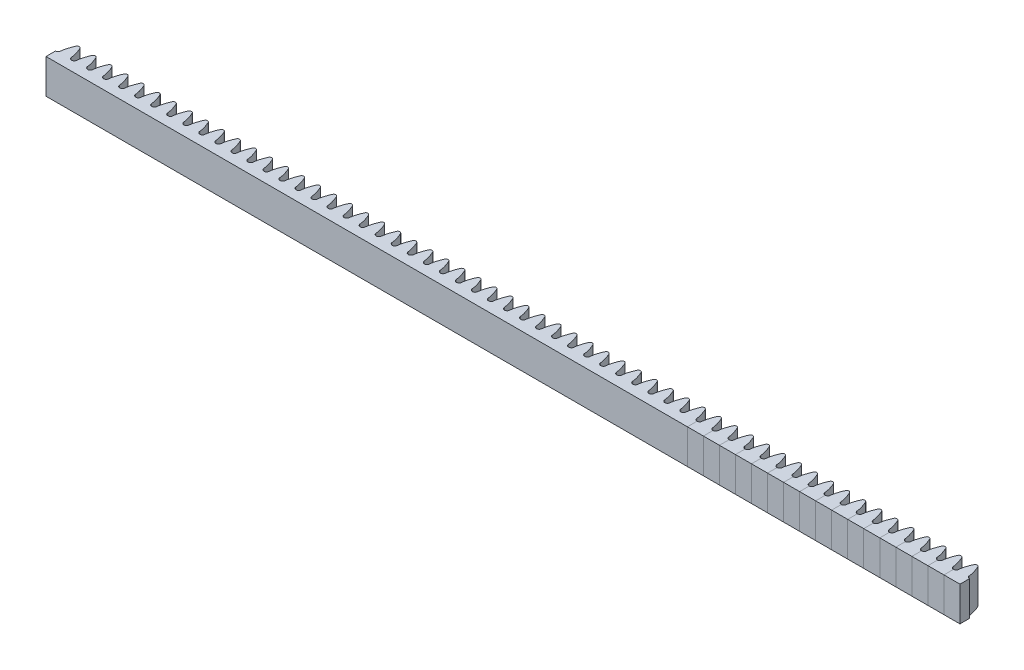
from build123d import *

# Parameters (mm, degrees)
BOSS_EXTRUDE1_DEPTH = 22.86
FILLET1_R           = 1.397
LPATTERN1_COUNT     = 57
LPATTERN1_PITCH     = 10.63952712
SKETCH4_W           = 425.581084806
SKETCH4_H           = 3.175
BOSS_EXTRUDE2_DEPTH = 2.54


with BuildPart() as part:
    # Sketch3 → Boss-Extrude1 (new body)
    with BuildSketch(Plane(origin=(0, 0, 0), x_dir=(1, 0, 0), z_dir=(0, 1, 0))):
        with BuildLine():
            Line((0, -1.750000056), (0, -8.100000056))
            Line((0, -8.100000056), (5.31976356, -8.100000056))
            Line((5.31976356, -8.100000056), (5.31976356, 10.38733641))
            add(Edge.make_bspline(
                [(1.74974471, -0.029893936), (1.750427218, 0.010054461), (1.753658097, 0.081117044), (1.769849983, 0.293177298), (1.812651285, 0.68152723), (1.940138764, 1.498629984), (2.206150355, 2.691050811), (2.620272364, 4.122963174), (3.276086552, 6.018940679), (4.162953405, 8.118570491), (4.960469139, 9.712016225), (5.31976356, 10.38733641)],
                knots=[0, 0, 0, 0, 0.000976543, 0.001953087, 0.003906174, 0.007812348, 0.015624695, 0.023437043, 0.03124939, 0.046874085, 0.058597865, 0.058597865, 0.058597865, 0.058597865], degree=3))
            ThreePointArc((1.74974471, -0.029893936), (1.226822278, -1.247961255), (0, -1.750000056))
        make_face()
    boss_extrude1 = extrude(amount=BOSS_EXTRUDE1_DEPTH)

    # Mirror1: Boss-Extrude1 across plane
    add(boss_extrude1.mirror(Plane(origin=(5.31976356, 22.86, 0), x_dir=(0, 0, 1), z_dir=(1, 0, 0))))

    # Fillet1
    fillet1_edges = [part.edges().sort_by_distance(p)[0] for p in [
        (5.31976356, 11.43, -10.38733641),
    ]]
    fillet(fillet1_edges, radius=FILLET1_R)


with BuildPart() as lpattern1_1:
    # LPattern1: pattern copy
    add(part.part.moved(Location(Vector(1, 0, 0) * (1 * LPATTERN1_PITCH))))


with BuildPart() as lpattern1_2:
    # LPattern1: pattern copy
    add(part.part.moved(Location(Vector(1, 0, 0) * (2 * LPATTERN1_PITCH))))


with BuildPart() as lpattern1_3:
    # LPattern1: pattern copy
    add(part.part.moved(Location(Vector(1, 0, 0) * (3 * LPATTERN1_PITCH))))


with BuildPart() as lpattern1_4:
    # LPattern1: pattern copy
    add(part.part.moved(Location(Vector(1, 0, 0) * (4 * LPATTERN1_PITCH))))


with BuildPart() as lpattern1_5:
    # LPattern1: pattern copy
    add(part.part.moved(Location(Vector(1, 0, 0) * (5 * LPATTERN1_PITCH))))


with BuildPart() as lpattern1_6:
    # LPattern1: pattern copy
    add(part.part.moved(Location(Vector(1, 0, 0) * (6 * LPATTERN1_PITCH))))


with BuildPart() as lpattern1_7:
    # LPattern1: pattern copy
    add(part.part.moved(Location(Vector(1, 0, 0) * (7 * LPATTERN1_PITCH))))


with BuildPart() as lpattern1_8:
    # LPattern1: pattern copy
    add(part.part.moved(Location(Vector(1, 0, 0) * (8 * LPATTERN1_PITCH))))


with BuildPart() as lpattern1_9:
    # LPattern1: pattern copy
    add(part.part.moved(Location(Vector(1, 0, 0) * (9 * LPATTERN1_PITCH))))


with BuildPart() as lpattern1_10:
    # LPattern1: pattern copy
    add(part.part.moved(Location(Vector(1, 0, 0) * (10 * LPATTERN1_PITCH))))


with BuildPart() as lpattern1_11:
    # LPattern1: pattern copy
    add(part.part.moved(Location(Vector(1, 0, 0) * (11 * LPATTERN1_PITCH))))


with BuildPart() as lpattern1_12:
    # LPattern1: pattern copy
    add(part.part.moved(Location(Vector(1, 0, 0) * (12 * LPATTERN1_PITCH))))


with BuildPart() as lpattern1_13:
    # LPattern1: pattern copy
    add(part.part.moved(Location(Vector(1, 0, 0) * (13 * LPATTERN1_PITCH))))


with BuildPart() as lpattern1_14:
    # LPattern1: pattern copy
    add(part.part.moved(Location(Vector(1, 0, 0) * (14 * LPATTERN1_PITCH))))


with BuildPart() as lpattern1_15:
    # LPattern1: pattern copy
    add(part.part.moved(Location(Vector(1, 0, 0) * (15 * LPATTERN1_PITCH))))


with BuildPart() as lpattern1_16:
    # LPattern1: pattern copy
    add(part.part.moved(Location(Vector(1, 0, 0) * (16 * LPATTERN1_PITCH))))


with BuildPart() as lpattern1_17:
    # LPattern1: pattern copy
    add(part.part.moved(Location(Vector(1, 0, 0) * (17 * LPATTERN1_PITCH))))


with BuildPart() as lpattern1_18:
    # LPattern1: pattern copy
    add(part.part.moved(Location(Vector(1, 0, 0) * (18 * LPATTERN1_PITCH))))


with BuildPart() as lpattern1_19:
    # LPattern1: pattern copy
    add(part.part.moved(Location(Vector(1, 0, 0) * (19 * LPATTERN1_PITCH))))


with BuildPart() as lpattern1_20:
    # LPattern1: pattern copy
    add(part.part.moved(Location(Vector(1, 0, 0) * (20 * LPATTERN1_PITCH))))


with BuildPart() as lpattern1_21:
    # LPattern1: pattern copy
    add(part.part.moved(Location(Vector(1, 0, 0) * (21 * LPATTERN1_PITCH))))


with BuildPart() as lpattern1_22:
    # LPattern1: pattern copy
    add(part.part.moved(Location(Vector(1, 0, 0) * (22 * LPATTERN1_PITCH))))


with BuildPart() as lpattern1_23:
    # LPattern1: pattern copy
    add(part.part.moved(Location(Vector(1, 0, 0) * (23 * LPATTERN1_PITCH))))


with BuildPart() as lpattern1_24:
    # LPattern1: pattern copy
    add(part.part.moved(Location(Vector(1, 0, 0) * (24 * LPATTERN1_PITCH))))


with BuildPart() as lpattern1_25:
    # LPattern1: pattern copy
    add(part.part.moved(Location(Vector(1, 0, 0) * (25 * LPATTERN1_PITCH))))


with BuildPart() as lpattern1_26:
    # LPattern1: pattern copy
    add(part.part.moved(Location(Vector(1, 0, 0) * (26 * LPATTERN1_PITCH))))


with BuildPart() as lpattern1_27:
    # LPattern1: pattern copy
    add(part.part.moved(Location(Vector(1, 0, 0) * (27 * LPATTERN1_PITCH))))


with BuildPart() as lpattern1_28:
    # LPattern1: pattern copy
    add(part.part.moved(Location(Vector(1, 0, 0) * (28 * LPATTERN1_PITCH))))


with BuildPart() as lpattern1_29:
    # LPattern1: pattern copy
    add(part.part.moved(Location(Vector(1, 0, 0) * (29 * LPATTERN1_PITCH))))


with BuildPart() as lpattern1_30:
    # LPattern1: pattern copy
    add(part.part.moved(Location(Vector(1, 0, 0) * (30 * LPATTERN1_PITCH))))


with BuildPart() as lpattern1_31:
    # LPattern1: pattern copy
    add(part.part.moved(Location(Vector(1, 0, 0) * (31 * LPATTERN1_PITCH))))


with BuildPart() as lpattern1_32:
    # LPattern1: pattern copy
    add(part.part.moved(Location(Vector(1, 0, 0) * (32 * LPATTERN1_PITCH))))


with BuildPart() as lpattern1_33:
    # LPattern1: pattern copy
    add(part.part.moved(Location(Vector(1, 0, 0) * (33 * LPATTERN1_PITCH))))


with BuildPart() as lpattern1_34:
    # LPattern1: pattern copy
    add(part.part.moved(Location(Vector(1, 0, 0) * (34 * LPATTERN1_PITCH))))


with BuildPart() as lpattern1_35:
    # LPattern1: pattern copy
    add(part.part.moved(Location(Vector(1, 0, 0) * (35 * LPATTERN1_PITCH))))


with BuildPart() as lpattern1_36:
    # LPattern1: pattern copy
    add(part.part.moved(Location(Vector(1, 0, 0) * (36 * LPATTERN1_PITCH))))


with BuildPart() as lpattern1_37:
    # LPattern1: pattern copy
    add(part.part.moved(Location(Vector(1, 0, 0) * (37 * LPATTERN1_PITCH))))


with BuildPart() as lpattern1_38:
    # LPattern1: pattern copy
    add(part.part.moved(Location(Vector(1, 0, 0) * (38 * LPATTERN1_PITCH))))


with BuildPart() as lpattern1_39:
    # LPattern1: pattern copy
    add(part.part.moved(Location(Vector(1, 0, 0) * (39 * LPATTERN1_PITCH))))


with BuildPart() as lpattern1_40:
    # LPattern1: pattern copy
    add(part.part.moved(Location(Vector(1, 0, 0) * (40 * LPATTERN1_PITCH))))


with BuildPart() as lpattern1_41:
    # LPattern1: pattern copy
    add(part.part.moved(Location(Vector(1, 0, 0) * (41 * LPATTERN1_PITCH))))


with BuildPart() as lpattern1_42:
    # LPattern1: pattern copy
    add(part.part.moved(Location(Vector(1, 0, 0) * (42 * LPATTERN1_PITCH))))


with BuildPart() as lpattern1_43:
    # LPattern1: pattern copy
    add(part.part.moved(Location(Vector(1, 0, 0) * (43 * LPATTERN1_PITCH))))


with BuildPart() as lpattern1_44:
    # LPattern1: pattern copy
    add(part.part.moved(Location(Vector(1, 0, 0) * (44 * LPATTERN1_PITCH))))


with BuildPart() as lpattern1_45:
    # LPattern1: pattern copy
    add(part.part.moved(Location(Vector(1, 0, 0) * (45 * LPATTERN1_PITCH))))


with BuildPart() as lpattern1_46:
    # LPattern1: pattern copy
    add(part.part.moved(Location(Vector(1, 0, 0) * (46 * LPATTERN1_PITCH))))


with BuildPart() as lpattern1_47:
    # LPattern1: pattern copy
    add(part.part.moved(Location(Vector(1, 0, 0) * (47 * LPATTERN1_PITCH))))


with BuildPart() as lpattern1_48:
    # LPattern1: pattern copy
    add(part.part.moved(Location(Vector(1, 0, 0) * (48 * LPATTERN1_PITCH))))


with BuildPart() as lpattern1_49:
    # LPattern1: pattern copy
    add(part.part.moved(Location(Vector(1, 0, 0) * (49 * LPATTERN1_PITCH))))


with BuildPart() as lpattern1_50:
    # LPattern1: pattern copy
    add(part.part.moved(Location(Vector(1, 0, 0) * (50 * LPATTERN1_PITCH))))


with BuildPart() as lpattern1_51:
    # LPattern1: pattern copy
    add(part.part.moved(Location(Vector(1, 0, 0) * (51 * LPATTERN1_PITCH))))


with BuildPart() as lpattern1_52:
    # LPattern1: pattern copy
    add(part.part.moved(Location(Vector(1, 0, 0) * (52 * LPATTERN1_PITCH))))


with BuildPart() as lpattern1_53:
    # LPattern1: pattern copy
    add(part.part.moved(Location(Vector(1, 0, 0) * (53 * LPATTERN1_PITCH))))


with BuildPart() as lpattern1_54:
    # LPattern1: pattern copy
    add(part.part.moved(Location(Vector(1, 0, 0) * (54 * LPATTERN1_PITCH))))


with BuildPart() as lpattern1_55:
    # LPattern1: pattern copy
    add(part.part.moved(Location(Vector(1, 0, 0) * (55 * LPATTERN1_PITCH))))


with BuildPart() as lpattern1_56:
    # LPattern1: pattern copy
    add(part.part.moved(Location(Vector(1, 0, 0) * (56 * LPATTERN1_PITCH))))


with BuildPart() as part_1:
    add(part.part)

    add(lpattern1_1.part)  # Boss-Extrude2 merges LPattern1_1

    add(lpattern1_2.part)  # Boss-Extrude2 merges LPattern1_2

    add(lpattern1_3.part)  # Boss-Extrude2 merges LPattern1_3

    add(lpattern1_4.part)  # Boss-Extrude2 merges LPattern1_4

    add(lpattern1_5.part)  # Boss-Extrude2 merges LPattern1_5

    add(lpattern1_6.part)  # Boss-Extrude2 merges LPattern1_6

    add(lpattern1_7.part)  # Boss-Extrude2 merges LPattern1_7

    add(lpattern1_8.part)  # Boss-Extrude2 merges LPattern1_8

    add(lpattern1_9.part)  # Boss-Extrude2 merges LPattern1_9

    add(lpattern1_10.part)  # Boss-Extrude2 merges LPattern1_10

    add(lpattern1_11.part)  # Boss-Extrude2 merges LPattern1_11

    add(lpattern1_12.part)  # Boss-Extrude2 merges LPattern1_12

    add(lpattern1_13.part)  # Boss-Extrude2 merges LPattern1_13

    add(lpattern1_14.part)  # Boss-Extrude2 merges LPattern1_14

    add(lpattern1_15.part)  # Boss-Extrude2 merges LPattern1_15

    add(lpattern1_16.part)  # Boss-Extrude2 merges LPattern1_16

    add(lpattern1_17.part)  # Boss-Extrude2 merges LPattern1_17

    add(lpattern1_18.part)  # Boss-Extrude2 merges LPattern1_18

    add(lpattern1_19.part)  # Boss-Extrude2 merges LPattern1_19

    add(lpattern1_20.part)  # Boss-Extrude2 merges LPattern1_20

    add(lpattern1_21.part)  # Boss-Extrude2 merges LPattern1_21

    add(lpattern1_22.part)  # Boss-Extrude2 merges LPattern1_22

    add(lpattern1_23.part)  # Boss-Extrude2 merges LPattern1_23

    add(lpattern1_24.part)  # Boss-Extrude2 merges LPattern1_24

    add(lpattern1_25.part)  # Boss-Extrude2 merges LPattern1_25

    add(lpattern1_26.part)  # Boss-Extrude2 merges LPattern1_26

    add(lpattern1_27.part)  # Boss-Extrude2 merges LPattern1_27

    add(lpattern1_28.part)  # Boss-Extrude2 merges LPattern1_28

    add(lpattern1_29.part)  # Boss-Extrude2 merges LPattern1_29

    add(lpattern1_30.part)  # Boss-Extrude2 merges LPattern1_30

    add(lpattern1_31.part)  # Boss-Extrude2 merges LPattern1_31

    add(lpattern1_32.part)  # Boss-Extrude2 merges LPattern1_32

    add(lpattern1_33.part)  # Boss-Extrude2 merges LPattern1_33

    add(lpattern1_34.part)  # Boss-Extrude2 merges LPattern1_34

    add(lpattern1_35.part)  # Boss-Extrude2 merges LPattern1_35

    add(lpattern1_36.part)  # Boss-Extrude2 merges LPattern1_36

    add(lpattern1_37.part)  # Boss-Extrude2 merges LPattern1_37

    add(lpattern1_38.part)  # Boss-Extrude2 merges LPattern1_38

    add(lpattern1_39.part)  # Boss-Extrude2 merges LPattern1_39
    # Sketch4 → Boss-Extrude2 (add)
    with BuildSketch(Plane(origin=(0, 22.86, 0), x_dir=(1, 0, 0), z_dir=(0, 1, 0))):
        with Locations((212.790542403, -6.512500056)):
            Rectangle(SKETCH4_W, SKETCH4_H)
    extrude(amount=-BOSS_EXTRUDE2_DEPTH)


solid = Compound([lpattern1_40.part, lpattern1_41.part, lpattern1_42.part, lpattern1_43.part, lpattern1_44.part, lpattern1_45.part, lpattern1_46.part, lpattern1_47.part, lpattern1_48.part, lpattern1_49.part, lpattern1_50.part, lpattern1_51.part, lpattern1_52.part, lpattern1_53.part, lpattern1_54.part, lpattern1_55.part, lpattern1_56.part, part_1.part])
